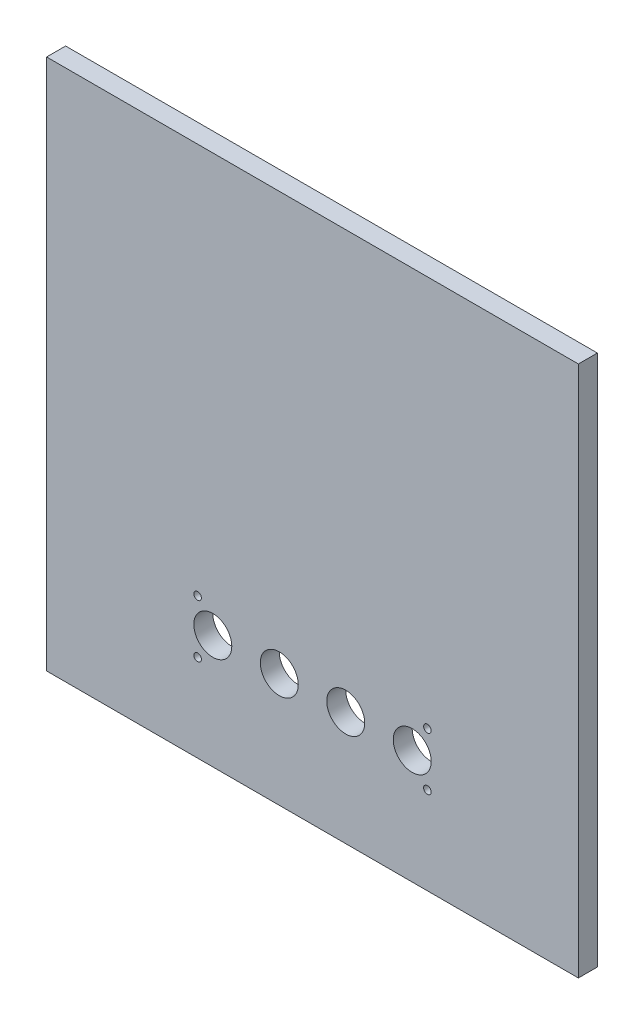
from build123d import *

# Parameters (mm, degrees)
SKETCH1_W           = 140
SKETCH1_H           = 140
SKETCH1_W_2         = 68.5
SKETCH1_H_2         = 22
BOSS_EXTRUDE1_DEPTH = 5
SKETCH1_4_W         = 140
SKETCH1_4_H         = 140
SKETCH1_4_R         = 5
SKETCH1_4_R_2       = 1
BOSS_EXTRUDE3_DEPTH = 5


with BuildPart() as part:
    # Sketch1 → Boss-Extrude1 (new body)
    with BuildSketch(Plane.XY):
        with Locations((-39.065487154, -26.144980504)):
            Rectangle(SKETCH1_W, SKETCH1_H)
        with Locations((-39.065487154, -66.144980504)):
            Rectangle(SKETCH1_W_2, SKETCH1_H_2, mode=Mode.SUBTRACT)
    extrude(amount=BOSS_EXTRUDE1_DEPTH)

    # Sketch1<4> → Boss-Extrude3 (add)
    with BuildSketch(Plane.XY):
        with Locations((-39.065487154, -26.144980504)):
            Rectangle(SKETCH1_4_W, SKETCH1_4_H)
        with Locations((-30.315487154, -66.144980504)):
            Circle(SKETCH1_4_R, mode=Mode.SUBTRACT)
        with Locations((-8.815487154, -73.144980504)):
            Circle(SKETCH1_4_R_2, mode=Mode.SUBTRACT)
        with Locations((-12.815487154, -66.144980504)):
            Circle(SKETCH1_4_R, mode=Mode.SUBTRACT)
        with Locations((-8.815487154, -59.144980504)):
            Circle(SKETCH1_4_R_2, mode=Mode.SUBTRACT)
        with Locations((-69.315487154, -73.144980504)):
            Circle(SKETCH1_4_R_2, mode=Mode.SUBTRACT)
        with Locations((-65.315487154, -66.144980504)):
            Circle(SKETCH1_4_R, mode=Mode.SUBTRACT)
        with Locations((-47.815487154, -66.144980504)):
            Circle(SKETCH1_4_R, mode=Mode.SUBTRACT)
        with Locations((-69.315487154, -59.144980504)):
            Circle(SKETCH1_4_R_2, mode=Mode.SUBTRACT)
    extrude(amount=BOSS_EXTRUDE3_DEPTH)


solid = part.part
